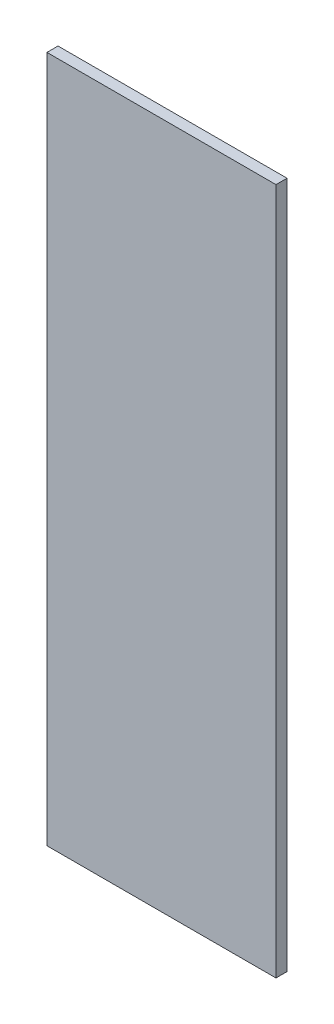
from build123d import *

# Parameters (mm, degrees)
CROQUIS1_W              = 60
CROQUIS1_H              = 180
SALIENTE_EXTRUIR1_DEPTH = 2.9


with BuildPart() as part:
    # Croquis1 → Saliente-Extruir1 (new body)
    with BuildSketch(Plane.XY):
        with Locations((30, 90)):
            Rectangle(CROQUIS1_W, CROQUIS1_H)
    extrude(amount=SALIENTE_EXTRUIR1_DEPTH)


solid = part.part
